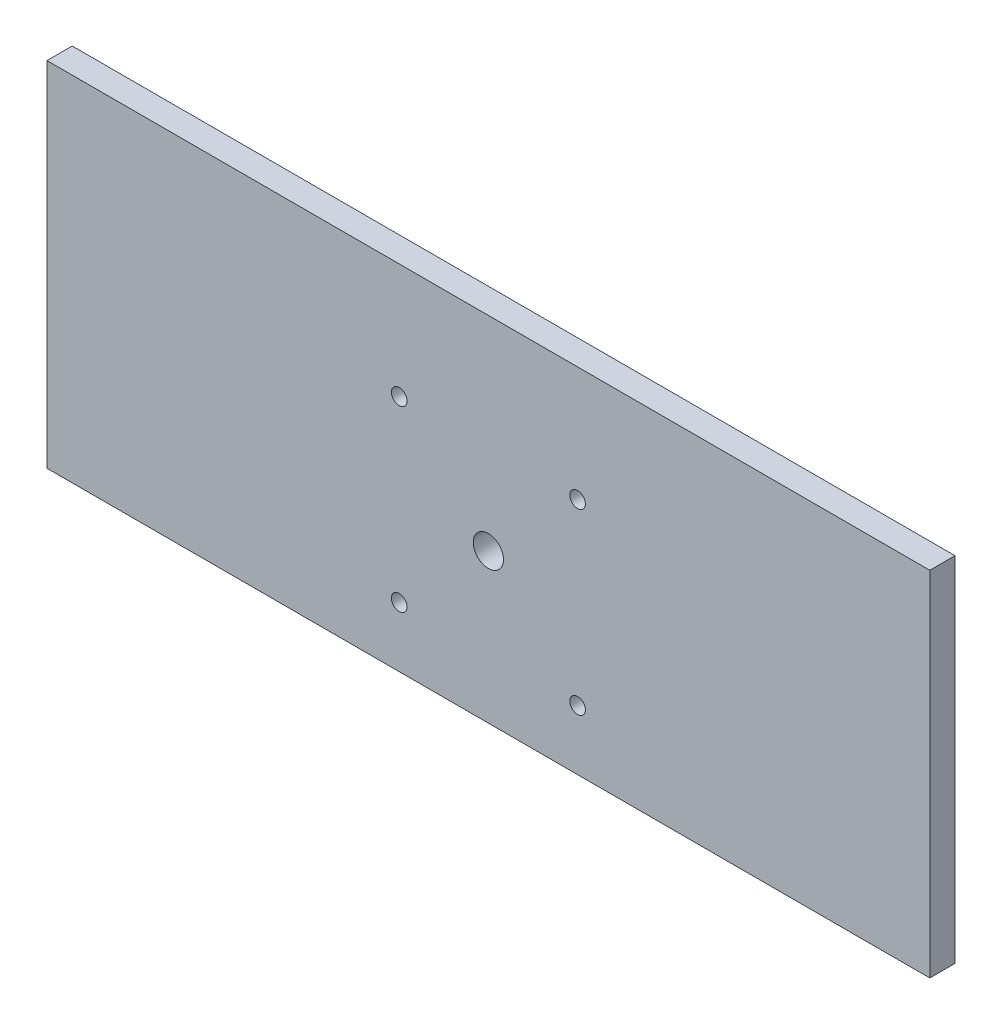
from build123d import *

# Parameters (mm, degrees)
SKETCH_1_W          = 175
SKETCH_1_H          = 70
EXTRUDE_1_DEPTH     = 5
SKETCH_2_R          = 3
SKETCH_2_R_2        = 1.55
CUT_EXTRUDE_1_DEPTH = 10


with BuildPart() as part:
    # 草图1 → 凸台-拉伸1 (new body)
    with BuildSketch(Plane.XY):
        with Locations((87.5, -60)):
            Rectangle(SKETCH_1_W, SKETCH_1_H)
    extrude(amount=EXTRUDE_1_DEPTH)

    # 草图2 → 切除-拉伸1 (cut)
    with BuildSketch(Plane.XY.offset(5)):
        with Locations((87.5, -65.45)):
            Circle(SKETCH_2_R)
        with Locations((69.82233047, -47.77233047)):
            Circle(SKETCH_2_R_2)
        with Locations((105.17766953, -47.77233047)):
            Circle(SKETCH_2_R_2)
        with Locations((105.17766953, -83.12766953)):
            Circle(SKETCH_2_R_2)
        with Locations((69.82233047, -83.12766953)):
            Circle(SKETCH_2_R_2)
    extrude(amount=-CUT_EXTRUDE_1_DEPTH, mode=Mode.SUBTRACT)


solid = part.part
